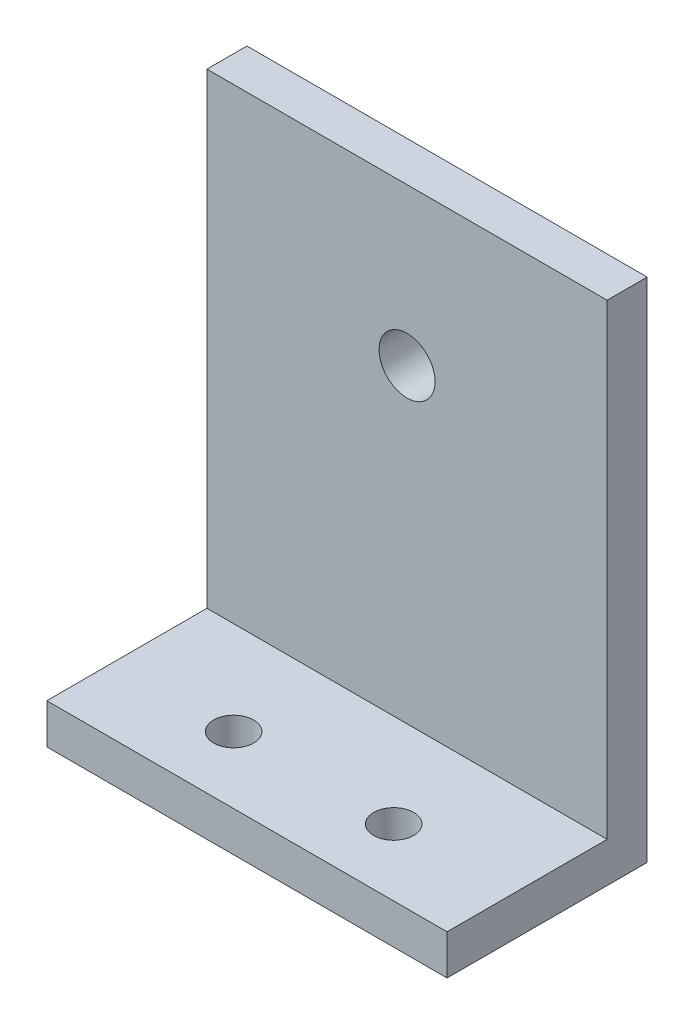
from build123d import *

# Parameters (mm, degrees)
EXTRUDE_1_DEPTH     = 30
CUT_EXTRUDE_1_REACH = 59.879
SKETCH_2_R          = 1.5
SKETCH_2_W          = 30
SKETCH_2_H          = 10
SKETCH_3_R          = 2.1
CUT_EXTRUDE_2_DEPTH = 53.440442409
SKETCH_4_W          = 30
SKETCH_4_H          = 3
CUT_EXTRUDE_3_DEPTH = 13


with BuildPart() as part:
    # 草图1 → 凸台-拉伸1 (new body)
    with BuildSketch(Plane(origin=(0, 0, 0), x_dir=(0, 0, -1), z_dir=(1, 0, 0))):
        Polygon((0, 0), (0, 35), (3, 35), (3, -3), (-35, -3), (-35, 0), align=None)
    extrude(amount=EXTRUDE_1_DEPTH)

    # 草图2 → 切除-拉伸1 (cut, up to next)
    with BuildSketch(Plane(origin=(0, 0, 0), x_dir=(1, 0, 0), z_dir=(0, 1, 0)), mode=Mode.PRIVATE) as cut_extrude_1_sk1:
        with Locations(Location((9, -7, 0), (0, 0, 270))):
            Circle(SKETCH_2_R)
    cut_extrude_1_tool1 = extrude(cut_extrude_1_sk1.sketch, amount=-CUT_EXTRUDE_1_REACH, mode=Mode.PRIVATE) & part.part
    # 草图2 → 切除-拉伸1 (cut, up to next)
    with BuildSketch(Plane(origin=(0, 0, 0), x_dir=(1, 0, 0), z_dir=(0, 1, 0)), mode=Mode.PRIVATE) as cut_extrude_1_sk2:
        with Locations(Location((9, -19, 0), (0, 0, 270))):
            Circle(SKETCH_2_R)
    cut_extrude_1_tool2 = extrude(cut_extrude_1_sk2.sketch, amount=-CUT_EXTRUDE_1_REACH, mode=Mode.PRIVATE) & part.part
    # 草图2 → 切除-拉伸1 (cut, up to next)
    with BuildSketch(Plane(origin=(0, 0, 0), x_dir=(1, 0, 0), z_dir=(0, 1, 0)), mode=Mode.PRIVATE) as cut_extrude_1_sk3:
        with Locations(Location((21, -19, 0), (0, 0, 270))):
            Circle(SKETCH_2_R)
    cut_extrude_1_tool3 = extrude(cut_extrude_1_sk3.sketch, amount=-CUT_EXTRUDE_1_REACH, mode=Mode.PRIVATE) & part.part
    # 草图2 → 切除-拉伸1 (cut, up to next)
    with BuildSketch(Plane(origin=(0, 0, 0), x_dir=(1, 0, 0), z_dir=(0, 1, 0)), mode=Mode.PRIVATE) as cut_extrude_1_sk4:
        with Locations(Location((21, -7, 0), (0, 0, 270))):
            Circle(SKETCH_2_R)
    cut_extrude_1_tool4 = extrude(cut_extrude_1_sk4.sketch, amount=-CUT_EXTRUDE_1_REACH, mode=Mode.PRIVATE) & part.part
    # 草图2 → 切除-拉伸1 (cut, up to next)
    with BuildSketch(Plane(origin=(0, 0, 0), x_dir=(1, 0, 0), z_dir=(0, 1, 0)), mode=Mode.PRIVATE) as cut_extrude_1_sk5:
        with Locations((15, -30)):
            Rectangle(SKETCH_2_W, SKETCH_2_H)
    cut_extrude_1_tool5 = extrude(cut_extrude_1_sk5.sketch, amount=-CUT_EXTRUDE_1_REACH, mode=Mode.PRIVATE) & part.part
    add(cut_extrude_1_tool1.solids().sort_by_distance((9, 0, 7))[0], mode=Mode.SUBTRACT)
    add(cut_extrude_1_tool2.solids().sort_by_distance((9, 0, 19))[0], mode=Mode.SUBTRACT)
    add(cut_extrude_1_tool3.solids().sort_by_distance((21, 0, 19))[0], mode=Mode.SUBTRACT)
    add(cut_extrude_1_tool4.solids().sort_by_distance((21, 0, 7))[0], mode=Mode.SUBTRACT)
    add(cut_extrude_1_tool5.solids().sort_by_distance((15, 0, 30))[0], mode=Mode.SUBTRACT)

    # 草图3 → 切除-拉伸2 (cut, through all)
    with BuildSketch(Plane.XY):
        with Locations((15, 23.25)):
            Circle(SKETCH_3_R)
    extrude(amount=-CUT_EXTRUDE_2_DEPTH, mode=Mode.SUBTRACT)

    # 草图4 → 切除-拉伸3 (cut)
    with BuildSketch(Plane.XY.offset(25)):
        with Locations((15, -1.5)):
            Rectangle(SKETCH_4_W, SKETCH_4_H)
    extrude(amount=-CUT_EXTRUDE_3_DEPTH, mode=Mode.SUBTRACT)


solid = part.part
